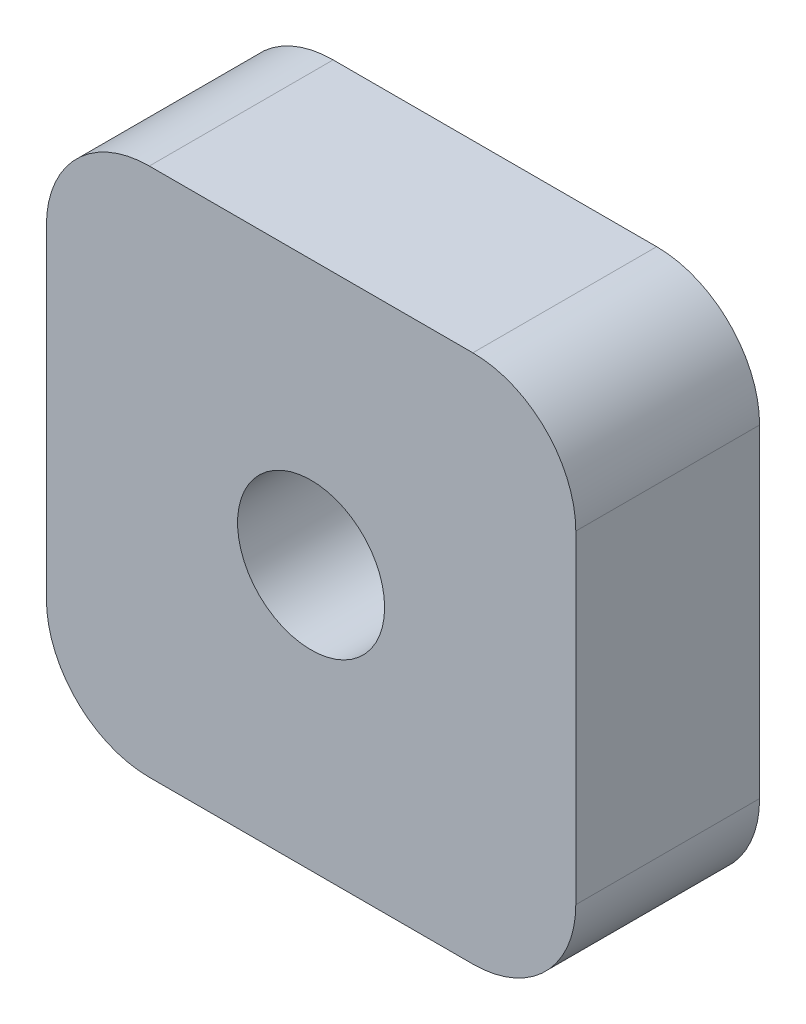
from build123d import *

# Parameters (mm, degrees)
ESBO_O1_R                       = 5
RESSALTO_EXTRUS_O1_DEPTH        = 12.5
FURO_ROSCADO_DE_M41_D           = 3.3
FURO_ROSCADO_DE_M41_DEPTH       = 7
FURO_ROSCADO_DE_M41_CBORE_D     = 4
FURO_ROSCADO_DE_M41_CBORE_DEPTH = 4
FURO_ROSCADO_DE_M41_TIP         = 0.991420021


with BuildPart() as part:
    # Esboço1 → Ressalto-extrusão1 (new body)
    with BuildSketch(Plane.XY):
        with BuildLine():
            Line((-11, 18), (11, 18))
            ThreePointArc((11, 18), (15.949747468, 15.949747468), (18, 11))
            Line((18, 11), (18, -11))
            ThreePointArc((18, -11), (15.949747468, -15.949747468), (11, -18))
            Line((11, -18), (-11, -18))
            ThreePointArc((-11, -18), (-15.949747468, -15.949747468), (-18, -11))
            Line((-18, -11), (-18, 11))
            ThreePointArc((-18, 11), (-15.949747468, 15.949747468), (-11, 18))
        make_face()
        Circle(ESBO_O1_R, mode=Mode.SUBTRACT)
    extrude(amount=RESSALTO_EXTRUS_O1_DEPTH)

    # Furo roscado de M41
    with Locations(Plane(origin=(0, 0, 0), x_dir=(-1, 0, 0), z_dir=(0, 0, -1))):
        with Locations((11, -11), (0, 0), (11, 11), (-11, -11), (-11, 11)):
            CounterBoreHole(FURO_ROSCADO_DE_M41_D / 2, FURO_ROSCADO_DE_M41_CBORE_D / 2, FURO_ROSCADO_DE_M41_CBORE_DEPTH, depth=FURO_ROSCADO_DE_M41_DEPTH)
            with Locations((0, 0, -(FURO_ROSCADO_DE_M41_DEPTH + FURO_ROSCADO_DE_M41_TIP / 2))):  # 118° drill point
                Cone(0, FURO_ROSCADO_DE_M41_D / 2, FURO_ROSCADO_DE_M41_TIP, mode=Mode.SUBTRACT)


solid = part.part
